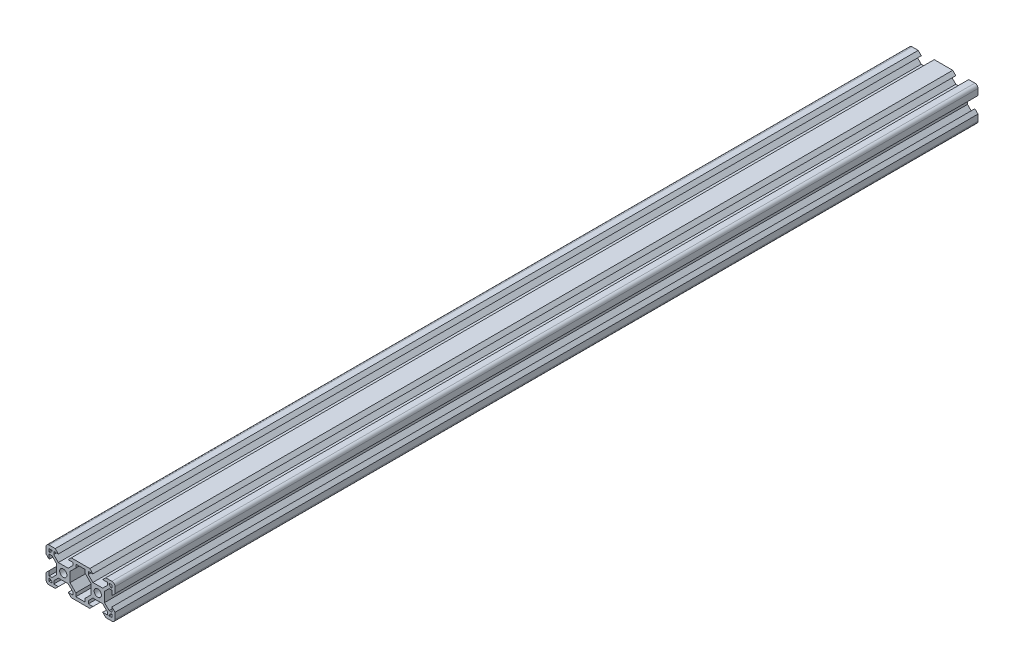
from build123d import *

# Parameters (mm, degrees)
ESQUISSE1_R        = 2.1
BOSS_EXTRU_1_DEPTH = 250


with BuildPart() as part:
    # Esquisse1 → Boss.-Extru.1 (new, symmetric)
    with BuildSketch(Plane.XY):
        with BuildLine():
            Line((-10, 3.900660172), (-12.84, 3.900660172))
            Line((-12.84, 3.900660172), (-15.499339828, 6.56))
            Line((-15.499339828, 6.56), (-15.499339828, 8.2))
            Line((-15.499339828, 8.2), (-12.84, 8.2))
            Line((-12.84, 8.2), (-14.64, 10))
            Line((-14.64, 10), (-18.2, 10))
            ThreePointArc((-18.2, 10), (-19.472792206, 9.472792206), (-20, 8.2))
            Line((-20, 8.2), (-20, 4.64))
            Line((-20, 4.64), (-18.2, 2.84))
            Line((-18.2, 2.84), (-18.2, 5.499339828))
            Line((-18.2, 5.499339828), (-16.56, 5.499339828))
            Line((-16.56, 5.499339828), (-13.900660172, 2.84))
            Line((-13.900660172, 2.84), (-13.900660172, 0))
            Line((-13.900660172, 0), (-13.900660172, -2.84))
            Line((-13.900660172, -2.84), (-16.56, -5.499339828))
            Line((-16.56, -5.499339828), (-18.2, -5.499339828))
            Line((-18.2, -5.499339828), (-18.2, -2.84))
            Line((-18.2, -2.84), (-20, -4.64))
            Line((-20, -4.64), (-20, -8.2))
            ThreePointArc((-20, -8.2), (-19.472792206, -9.472792206), (-18.2, -10))
            Line((-18.2, -10), (-14.64, -10))
            Line((-14.64, -10), (-12.84, -8.2))
            Line((-12.84, -8.2), (-15.499339828, -8.2))
            Line((-15.499339828, -8.2), (-15.499339828, -6.56))
            Line((-15.499339828, -6.56), (-12.84, -3.900660172))
            Line((-12.84, -3.900660172), (-10, -3.900660172))
            Line((-10, -3.900660172), (-7.16, -3.900660172))
            Line((-7.16, -3.900660172), (-4.500660172, -6.56))
            Line((-4.500660172, -6.56), (-4.500660172, -8.2))
            Line((-4.500660172, -8.2), (-7.16, -8.2))
            Line((-7.16, -8.2), (-5.36, -10))
            Line((-5.36, -10), (5.36, -10))
            Line((5.36, -10), (7.16, -8.2))
            Line((7.16, -8.2), (4.500660172, -8.2))
            Line((4.500660172, -8.2), (4.500660172, -6.56))
            Line((4.500660172, -6.56), (7.16, -3.900660172))
            Line((7.16, -3.900660172), (10, -3.900660172))
            Line((10, -3.900660172), (12.84, -3.900660172))
            Line((12.84, -3.900660172), (15.499339828, -6.56))
            Line((15.499339828, -6.56), (15.499339828, -8.2))
            Line((15.499339828, -8.2), (12.84, -8.2))
            Line((12.84, -8.2), (14.64, -10))
            Line((14.64, -10), (18.2, -10))
            ThreePointArc((18.2, -10), (19.472792206, -9.472792206), (20, -8.2))
            Line((20, -8.2), (20, -4.64))
            Line((20, -4.64), (18.2, -2.84))
            Line((18.2, -2.84), (18.2, -5.499339828))
            Line((18.2, -5.499339828), (16.56, -5.499339828))
            Line((16.56, -5.499339828), (13.900660172, -2.84))
            Line((13.900660172, -2.84), (13.900660172, 0))
            Line((13.900660172, 0), (13.900660172, 2.84))
            Line((13.900660172, 2.84), (16.56, 5.499339828))
            Line((16.56, 5.499339828), (18.2, 5.499339828))
            Line((18.2, 5.499339828), (18.2, 2.84))
            Line((18.2, 2.84), (20, 4.64))
            Line((20, 4.64), (20, 8.2))
            ThreePointArc((20, 8.2), (19.472792206, 9.472792206), (18.2, 10))
            Line((18.2, 10), (14.64, 10))
            Line((14.64, 10), (12.84, 8.2))
            Line((12.84, 8.2), (15.499339828, 8.2))
            Line((15.499339828, 8.2), (15.499339828, 6.56))
            Line((15.499339828, 6.56), (12.84, 3.900660172))
            Line((12.84, 3.900660172), (10, 3.900660172))
            Line((10, 3.900660172), (7.16, 3.900660172))
            Line((7.16, 3.900660172), (4.500660172, 6.56))
            Line((4.500660172, 6.56), (4.500660172, 8.2))
            Line((4.500660172, 8.2), (7.16, 8.2))
            Line((7.16, 8.2), (5.36, 10))
            Line((5.36, 10), (-5.36, 10))
            Line((-5.36, 10), (-7.16, 8.2))
            Line((-7.16, 8.2), (-4.500660172, 8.2))
            Line((-4.500660172, 8.2), (-4.500660172, 6.56))
            Line((-4.500660172, 6.56), (-7.16, 3.900660172))
            Line((-7.16, 3.900660172), (-10, 3.900660172))
        make_face()
        with Locations((-10, 0)):
            Circle(ESQUISSE1_R, mode=Mode.SUBTRACT)
        with Locations(Location((10, 0, 0), (0, 0, 180))):
            Circle(ESQUISSE1_R, mode=Mode.SUBTRACT)
        Polygon((-2.7, 8.2), (-2.7, 6.239339828), (-6.099339828, 2.84), (-6.099339828, -2.84), (-2.7, -6.239339828), (-2.7, -8.2), (2.7, -8.2), (2.7, -6.239339828), (6.099339828, -2.84), (6.099339828, 2.84), (2.7, 6.239339828), (2.7, 8.2), align=None, mode=Mode.SUBTRACT)
        Polygon((-18.2, 8.2), (-18.2, 6.569339828), (-17.63, 6.569339828), (-16.569339828, 7.63), (-16.569339828, 8.2), align=None, mode=Mode.SUBTRACT)
        Polygon((-18.2, -6.569339828), (-17.63, -6.569339828), (-16.569339828, -7.63), (-16.569339828, -8.2), (-18.2, -8.2), align=None, mode=Mode.SUBTRACT)
        Polygon((18.2, 6.569339828), (17.63, 6.569339828), (16.569339828, 7.63), (16.569339828, 8.2), (18.2, 8.2), align=None, mode=Mode.SUBTRACT)
        Polygon((18.2, -6.569339828), (17.63, -6.569339828), (16.569339828, -7.63), (16.569339828, -8.2), (18.2, -8.2), align=None, mode=Mode.SUBTRACT)
    extrude(amount=BOSS_EXTRU_1_DEPTH, both=True)


solid = part.part
